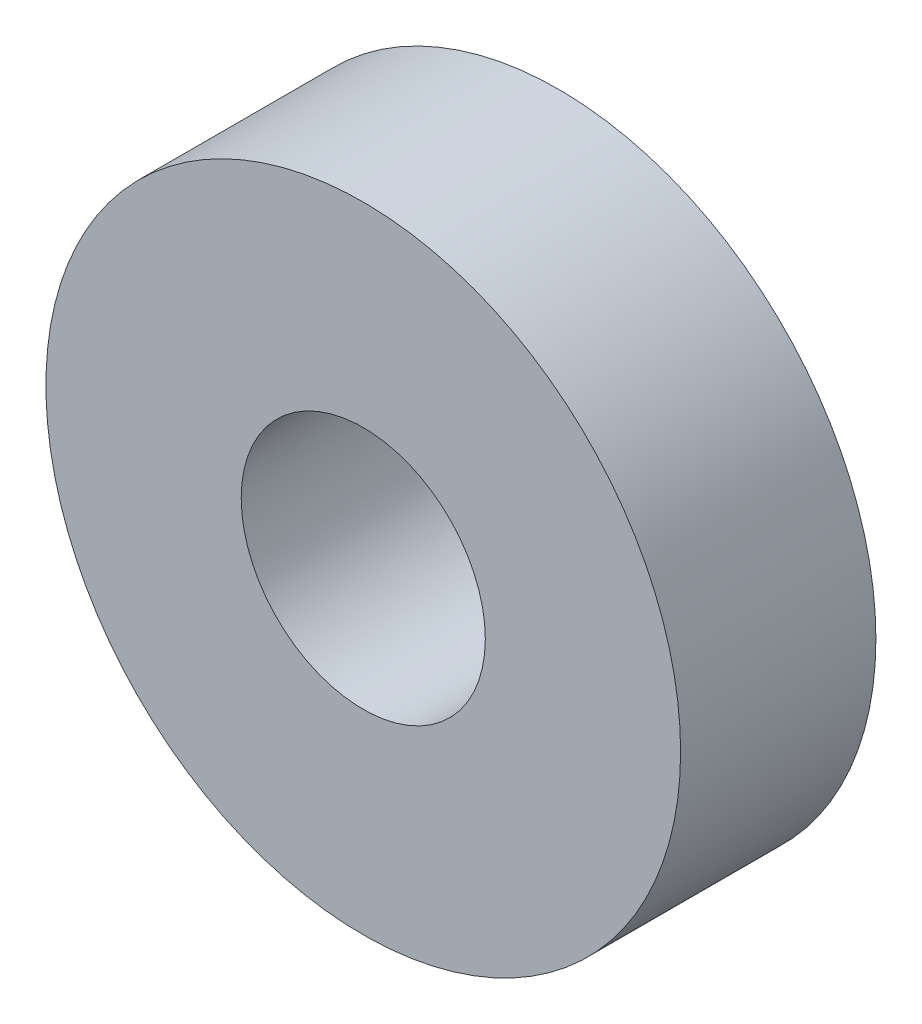
from build123d import *

# Parameters (mm, degrees)
SKETCH_4_R      = 3.25
SKETCH_4_R_2    = 1.25
EXTRUDE_2_DEPTH = 2


with BuildPart() as part:
    # Эскиз4 → Бобышка-Вытянуть2 (new body)
    with BuildSketch(Plane.XY):
        Circle(SKETCH_4_R)
        Circle(SKETCH_4_R_2, mode=Mode.SUBTRACT)
    extrude(amount=EXTRUDE_2_DEPTH)


solid = part.part
